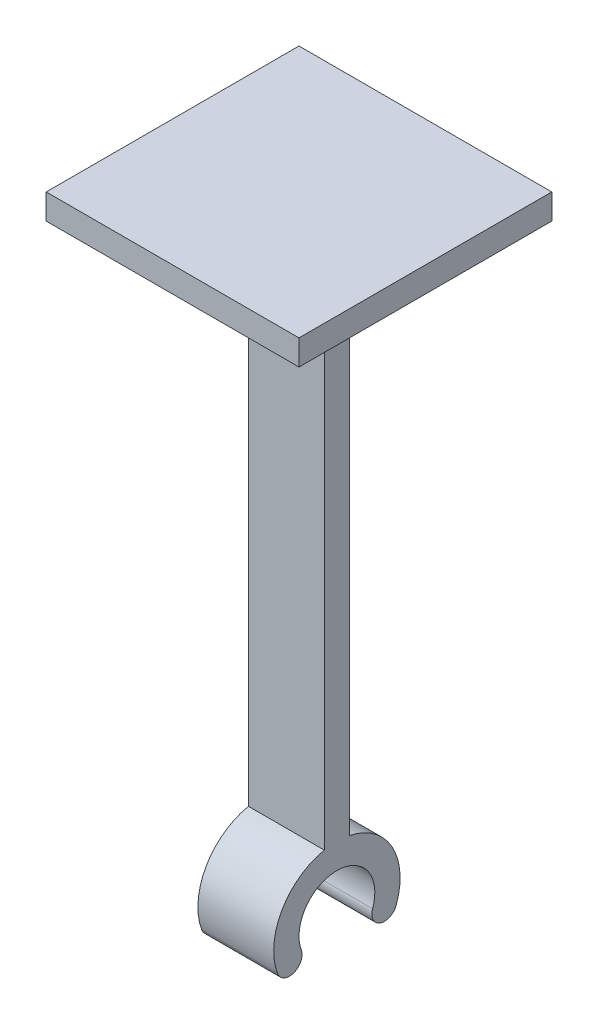
from build123d import *

# Parameters (mm, degrees)
BOSS_EXTRUDE1_DEPTH      = 3
BOSS_EXTRUDE1_DEPTH_BACK = 3
BOSS_EXTRUDE2_DEPTH      = 3
BOSS_EXTRUDE3_DEPTH      = 3
SKETCH4_W                = 20
SKETCH4_H                = 20
BOSS_EXTRUDE4_DEPTH      = 2


with BuildPart() as part:
    # Sketch1 → Boss-Extrude1 (new, two sides: drawn at the far end of the back side and taken through both)
    with BuildSketch(Plane(origin=(0, 0, 0), x_dir=(0, 0, -1), z_dir=(1, 0, 0)).offset(-BOSS_EXTRUDE1_DEPTH_BACK)):
        with BuildLine():
            ThreePointArc((-2.819077862, -1.02606043), (0, 3), (2.819077862, -1.02606043))
            ThreePointArc((2.819077862, -1.02606043), (3.41675034, -2.307773194), (4.698463104, -1.710100717))
            ThreePointArc((4.698463104, -1.710100717), (0, 5), (-4.698463104, -1.710100717))
            ThreePointArc((-4.698463104, -1.710100717), (-3.41675034, -2.307773194), (-2.819077862, -1.02606043))
        make_face()
    extrude(amount=BOSS_EXTRUDE1_DEPTH + BOSS_EXTRUDE1_DEPTH_BACK)

    # Sketch2 → Boss-Extrude2 (add)
    with BuildSketch(Plane(origin=(0, 0, 0), x_dir=(0, 0, -1), z_dir=(1, 0, 0))):
        Polygon((-1, 3), (0, 3), (1, 3), (1, 46), (-1, 46), align=None)
    extrude(amount=BOSS_EXTRUDE2_DEPTH)

    # Sketch3 → Boss-Extrude3 (add)
    with BuildSketch(Plane(origin=(0, 0, 0), x_dir=(0, 0, -1), z_dir=(1, 0, 0))):
        Polygon((1, 46), (0, 46), (-1, 46), (-1, 3), (1, 3), align=None)
    extrude(amount=-BOSS_EXTRUDE3_DEPTH)

    # Sketch4 → Boss-Extrude4 (add)
    with BuildSketch(Plane(origin=(0, 46, 0), x_dir=(1, 0, 0), z_dir=(0, 1, 0))):
        Rectangle(SKETCH4_W, SKETCH4_H)
    extrude(amount=BOSS_EXTRUDE4_DEPTH)


solid = part.part
